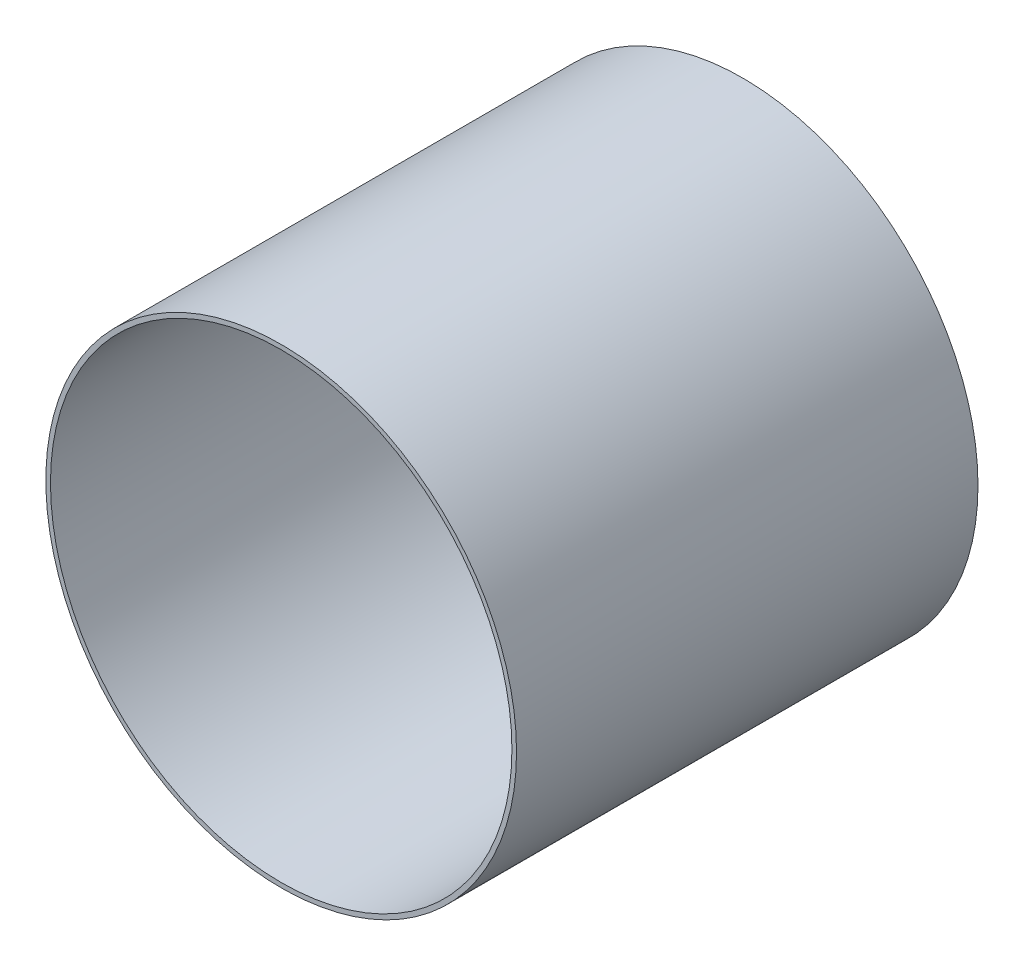
from build123d import *

# Parameters (mm, degrees)
SKETCH_1_R      = 102
SKETCH_1_R_2    = 100
EXTRUDE_1_DEPTH = 200


with BuildPart() as part:
    # Эскиз1 → Вытянуть-Тонкостенный1 (new body)
    with BuildSketch(Plane.XY):
        Circle(SKETCH_1_R)
        Circle(SKETCH_1_R_2, mode=Mode.SUBTRACT)
    extrude(amount=EXTRUDE_1_DEPTH)


solid = part.part
